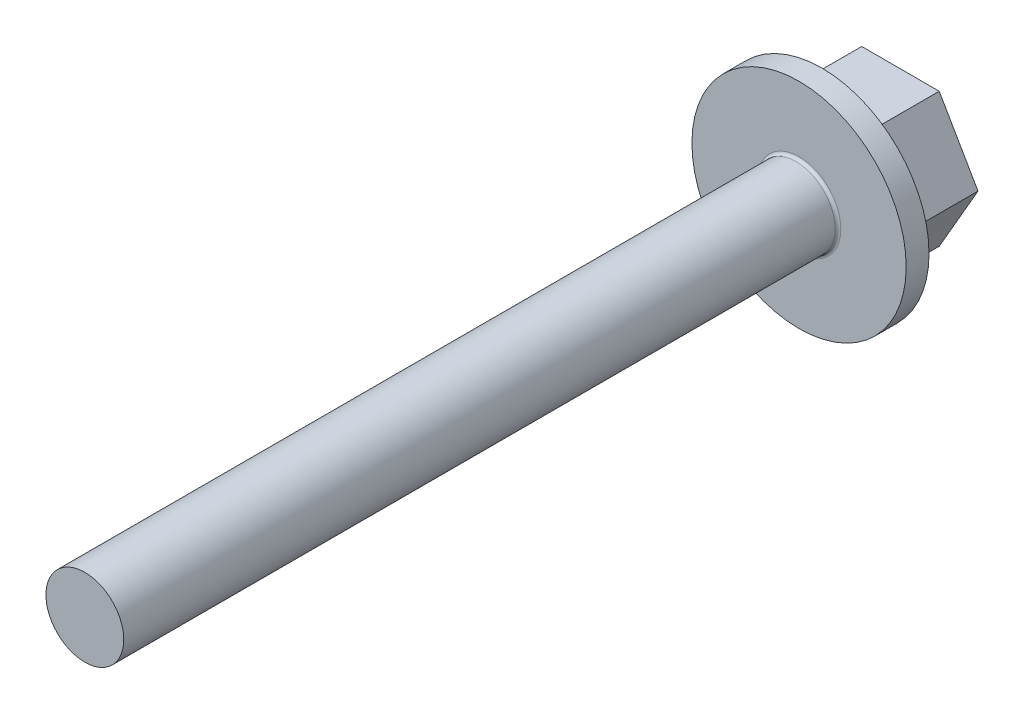
from build123d import *

# Parameters (mm, degrees)
BOSS_EXTRUDE1_DEPTH = 2.794
SKETCH2_R           = 3.81
BOSS_EXTRUDE2_DEPTH = 0.8128
SKETCH3_R           = 1.3843
BOSS_EXTRUDE3_DEPTH = 25.4
FILLET1_R           = 0.1016


with BuildPart() as part:
    # Sketch1 → Boss-Extrude1 (new body)
    with BuildSketch(Plane.XY):
        Polygon((2.756963005, 0), (1.378481503, 2.3876), (-1.378481503, 2.3876), (-2.756963005, 0), (-1.378481503, -2.3876), (1.378481503, -2.3876), align=None)
    extrude(amount=BOSS_EXTRUDE1_DEPTH)

    # Sketch2 → Boss-Extrude2 (add)
    with BuildSketch(Plane.XY.offset(2.794)):
        Circle(SKETCH2_R)
    extrude(amount=BOSS_EXTRUDE2_DEPTH)

    # Sketch3 → Boss-Extrude3 (add)
    with BuildSketch(Plane.XY.offset(3.6068)):
        Circle(SKETCH3_R)
    extrude(amount=BOSS_EXTRUDE3_DEPTH)

    # Fillet1
    fillet1_edges = [part.edges().sort_by_distance(p)[0] for p in [
        (-1.3843, 0, 3.6068),
    ]]
    fillet(fillet1_edges, radius=FILLET1_R)


solid = part.part
